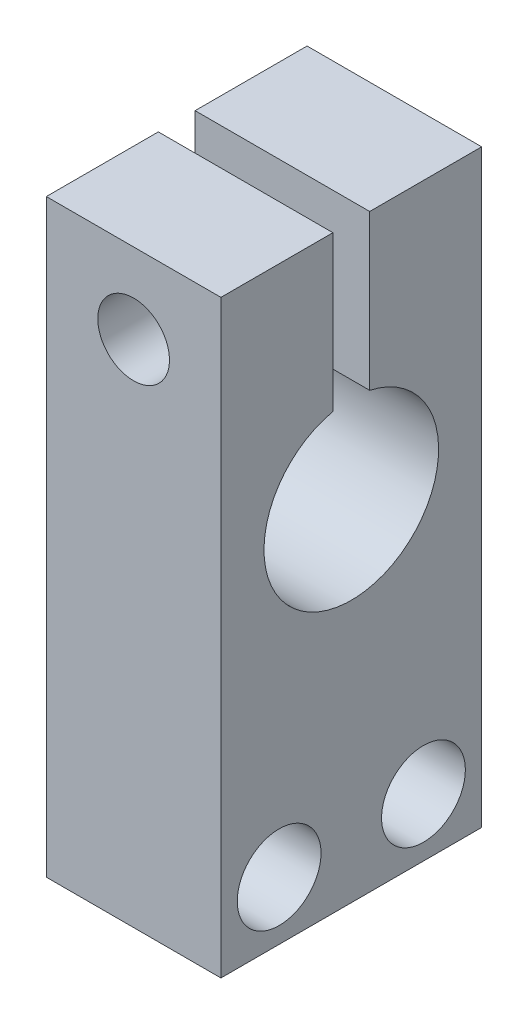
from build123d import *

# Parameters (mm, degrees)
SKETCH1_W                                          = 31.75
SKETCH1_H                                          = 32.1564
BOSS_EXTRUDE1_DEPTH                                = 9.525
SKETCH2_W                                          = 8.763
SKETCH2_H                                          = 32.1564
CUT_EXTRUDE1_DEPTH                                 = 27.563955842
CUT_EXTRUDE2_DEPTH                                 = 27.563955842
SKETCH4_W                                          = 8.763
SKETCH4_H                                          = 32.16
CUT_EXTRUDE3_DEPTH                                 = 27.563955842
SKETCH5_W                                          = 9.525
SKETCH5_H                                          = 4.7625
SKETCH6_W                                          = 1.3208
SKETCH6_H                                          = 6.1087
CBORE_FOR_M3_5_HEX_HEAD_MACHINE_SCREW1_D           = 3.9116
CBORE_FOR_M3_5_HEX_HEAD_MACHINE_SCREW1_DEPTH       = 14.224
CBORE_FOR_M3_5_HEX_HEAD_MACHINE_SCREW1_CBORE_D     = 7.1374
CBORE_FOR_M3_5_HEX_HEAD_MACHINE_SCREW1_CBORE_DEPTH = 3.9116
M4_CLEARANCE_HOLE1_D                               = 4.572


with BuildPart() as part:
    # Sketch1 → Boss-Extrude1 (new body)
    with BuildSketch(Plane(origin=(4.7625, 0, 0), x_dir=(0, 0, -1), z_dir=(1, 0, 0))):
        with Locations((0, -2.9718)):
            Rectangle(SKETCH1_W, SKETCH1_H)
    extrude(amount=-BOSS_EXTRUDE1_DEPTH)

    # Sketch2 → Cut-Extrude1 (cut, through all)
    with BuildSketch(Plane.ZY.offset(4.7625)):
        with Locations((-11.4935, -2.9718)):
            Rectangle(SKETCH2_W, SKETCH2_H)
    extrude(amount=-CUT_EXTRUDE1_DEPTH, mode=Mode.SUBTRACT)

    # Sketch3 → Cut-Extrude2 (cut, through all)
    with BuildSketch(Plane.ZY.offset(4.7625)):
        with BuildLine():
            Line((1.0033, 13.1064), (-1.0033, 13.1064))
            Line((-1.0033, 13.1064), (-1.0033, 4.655619761))
            ThreePointArc((-1.0033, 4.655619761), (0, 4.7625), (1.0033, 4.655619761))
            Line((1.0033, 4.655619761), (1.0033, 13.1064))
        make_face()
    extrude(amount=-CUT_EXTRUDE2_DEPTH, mode=Mode.SUBTRACT)

    # Sketch4 → Cut-Extrude3 (cut, through all)
    with BuildSketch(Plane.ZY.offset(4.7625)):
        with Locations((11.4935, -2.9736)):
            Rectangle(SKETCH4_W, SKETCH4_H)
    extrude(amount=-CUT_EXTRUDE3_DEPTH, mode=Mode.SUBTRACT)

    # Sketch5 → Cut-Revolve1 (revolve, cut)
    with BuildSketch(Plane.XY):
        with Locations((0, 2.38125)):
            Rectangle(SKETCH5_W, SKETCH5_H)
    revolve(axis=Axis((-4.7625, 0, 0), (1, 0, 0)), mode=Mode.SUBTRACT)

    # Sketch6 → Hole1 (revolve, cut)
    with BuildSketch(Plane(origin=(0, 8.7376, 1.0033), x_dir=(0, 1, 0), z_dir=(1, 0, 0))):
        with Locations((0.6604, 3.05435)):
            Rectangle(SKETCH6_W, SKETCH6_H)
    revolve(axis=Axis((0, 8.7376, 111.0033), (0, 0, -1)), mode=Mode.SUBTRACT)

    # CBORE for M3.5 Hex Head Machine Screw1
    with Locations(Plane(origin=(0, 0, -7.112), x_dir=(-1, 0, 0), z_dir=(0, 0, -1))):
        with Locations((0, 8.7376)):
            CounterBoreHole(CBORE_FOR_M3_5_HEX_HEAD_MACHINE_SCREW1_D / 2, CBORE_FOR_M3_5_HEX_HEAD_MACHINE_SCREW1_CBORE_D / 2, CBORE_FOR_M3_5_HEX_HEAD_MACHINE_SCREW1_CBORE_DEPTH, depth=CBORE_FOR_M3_5_HEX_HEAD_MACHINE_SCREW1_DEPTH)

    # M4 Clearance Hole1 (through all)
    with Locations(Plane(origin=(4.7625, -17.4625, 0), x_dir=(0, 1, 0), z_dir=(1, 0, 0))):
        with Locations((1.5875, -3.937), (1.5875, 3.937)):
            Hole(M4_CLEARANCE_HOLE1_D / 2)


solid = part.part
